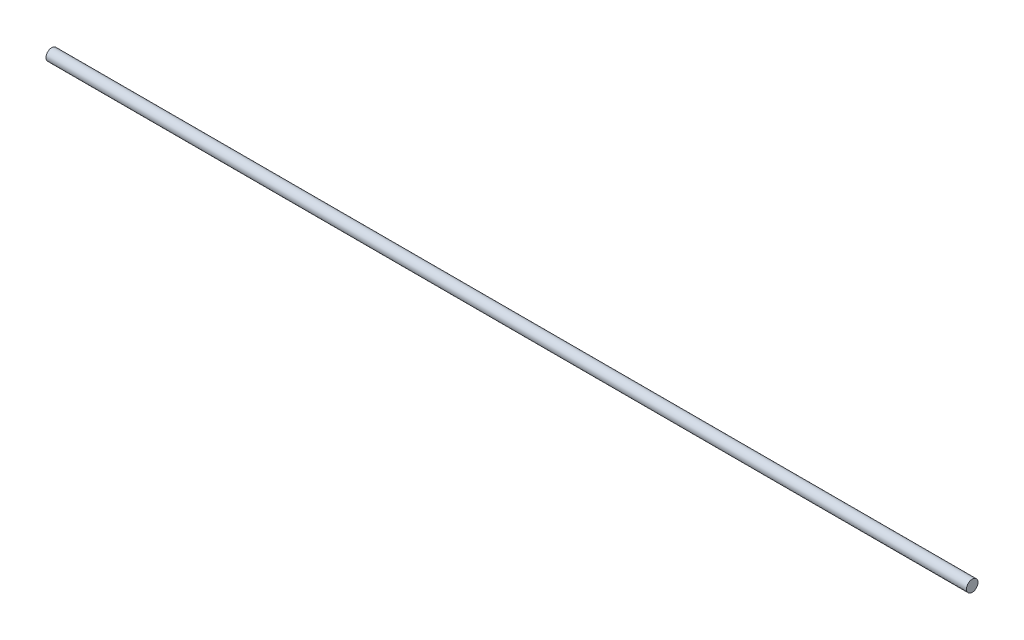
from build123d import *

# Parameters (mm, degrees)
SKETCH_1_R      = 10
EXTRUDE_1_DEPTH = 800


with BuildPart() as part:
    # Эскиз1 → Бобышка-Вытянуть1 (new, symmetric)
    with BuildSketch(Plane(origin=(0, 0, 0), x_dir=(0, 0, -1), z_dir=(1, 0, 0))):
        Circle(SKETCH_1_R)
    extrude(amount=EXTRUDE_1_DEPTH, both=True)


solid = part.part
